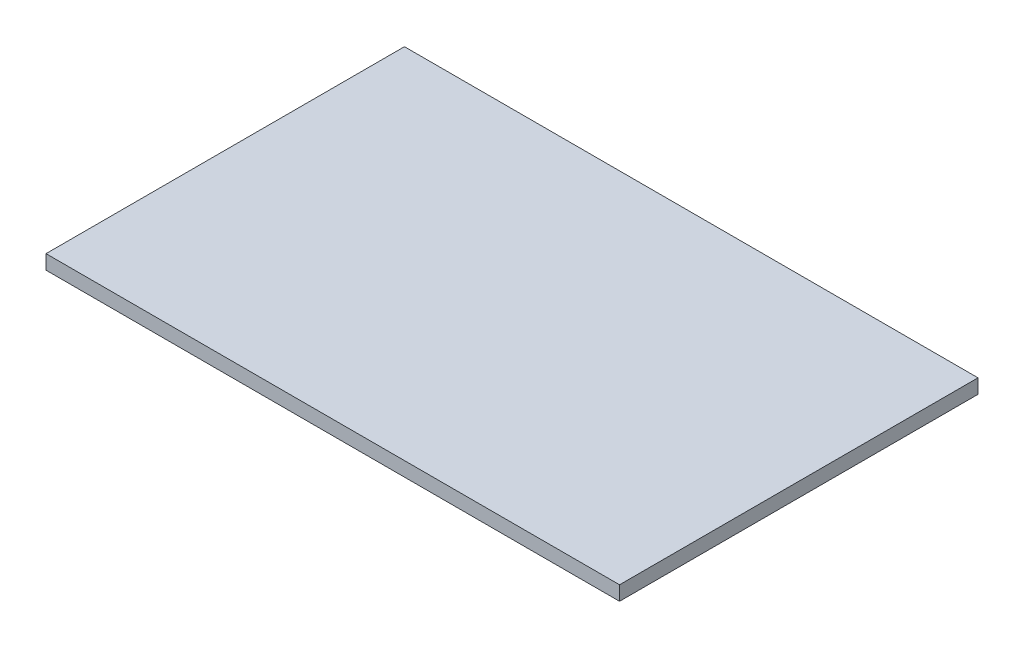
from build123d import *

# Parameters (mm, degrees)
SKETCH1_W           = 120
SKETCH1_H           = 75
BOSS_EXTRUDE1_DEPTH = 3


with BuildPart() as part:
    # Sketch1 → Boss-Extrude1 (new body)
    with BuildSketch(Plane(origin=(0, 0, 0), x_dir=(1, 0, 0), z_dir=(0, 1, 0))):
        with Locations((60, 37.5)):
            Rectangle(SKETCH1_W, SKETCH1_H)
    extrude(amount=BOSS_EXTRUDE1_DEPTH)


solid = part.part
